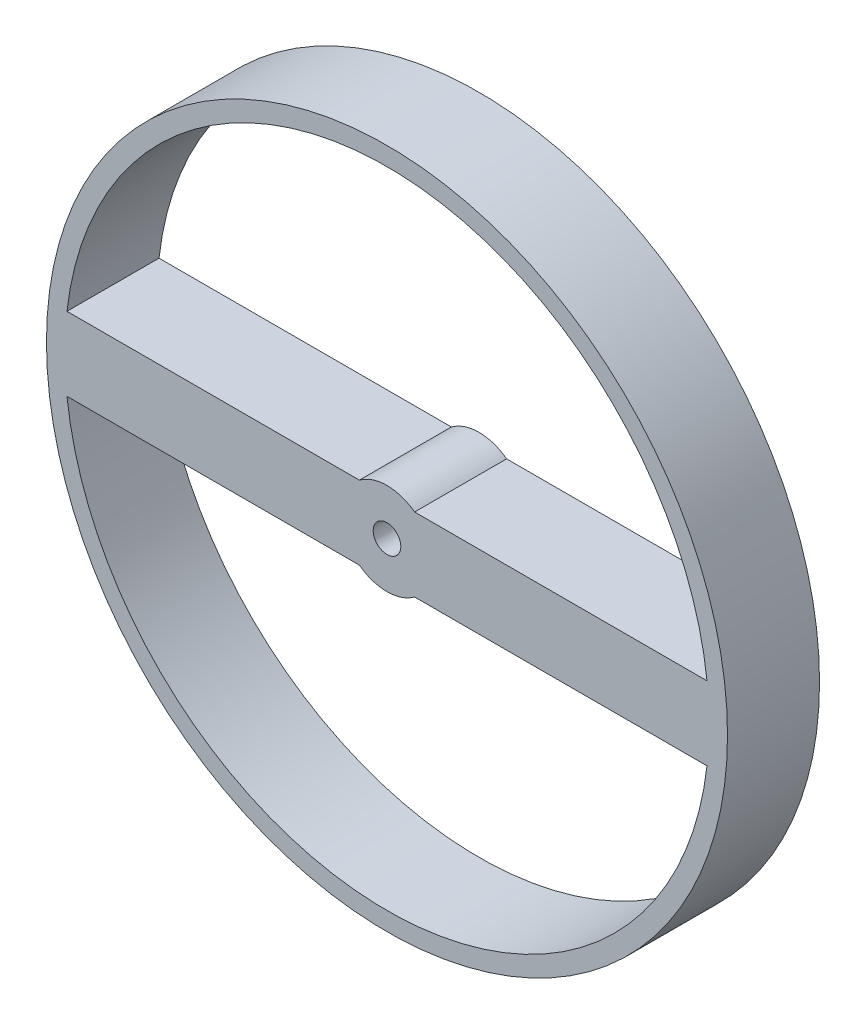
from build123d import *

# Parameters (mm, degrees)
CROQUIS1_R               = 18.5
SALIENTE_EXTRUIR1_DEPTH  = 5
CROQUIS2_R               = 0.75
CORTAR_EXTRUIR1_DEPTH    = 5
CROQUIS3_R               = 17.5
CROQUIS3_R_2             = 2.5
CORTAR_EXTRUIR4_DEPTH    = 5
SALIENTE_EXTRUIR11_START = -5
CROQUIS6_W               = 17.427059278
CROQUIS6_H               = 4
SALIENTE_EXTRUIR11_DEPTH = 5
CROQUIS8_W               = 17.261171747
CROQUIS8_H               = 4
SALIENTE_EXTRUIR12_DEPTH = 5


with BuildPart() as part:
    # Croquis1 → Saliente-Extruir1 (new body)
    with BuildSketch(Plane.XY):
        with Locations((-21.322301086, 7.958835432)):
            Circle(CROQUIS1_R)
    extrude(amount=SALIENTE_EXTRUIR1_DEPTH)

    # Croquis2 → Cortar-Extruir1 (cut)
    with BuildSketch(Plane(origin=(0, 0, 0), x_dir=(-1, 0, 0), z_dir=(0, 0, -1))):
        with Locations((21.322301086, 7.958835432)):
            Circle(CROQUIS2_R)
    extrude(amount=-CORTAR_EXTRUIR1_DEPTH, mode=Mode.SUBTRACT)

    # Croquis3 → Cortar-Extruir4 (cut)
    with BuildSketch(Plane.XY.offset(5)):
        with Locations((-21.322301086, 7.958835432)):
            Circle(CROQUIS3_R)
        with Locations((-21.322301086, 7.958835432)):
            Circle(CROQUIS3_R_2, mode=Mode.SUBTRACT)
    extrude(amount=-CORTAR_EXTRUIR4_DEPTH, mode=Mode.SUBTRACT)


with BuildPart() as cortar_extruir4_piece_1:
    # of the separate pieces the step leaves, piece 1, a body of its own (cortar_extruir4_pieces)
    add(part.part.solids().sort_by_distance((-2.822301086, 7.958835432, 0))[0])



with BuildPart() as cortar_extruir4_piece_2:
    # of the separate pieces the step leaves, piece 2, a body of its own (cortar_extruir4_pieces)
    add(part.part.solids().sort_by_distance((-18.822301086, 7.958835432, 0))[0])


with BuildPart() as cortar_extruir4_piece_1_1:
    add(cortar_extruir4_piece_1.part)

    add(cortar_extruir4_piece_2.part)  # Saliente-Extruir11 merges Cortar-Extruir4 piece 2
    # Croquis6 → Saliente-Extruir11 (add)
    with BuildSketch(Plane.XY.offset(5).offset(SALIENTE_EXTRUIR11_START)):
        with Locations((-31.000345605, 7.958835432)):
            Rectangle(CROQUIS6_W, CROQUIS6_H)
    extrude(amount=SALIENTE_EXTRUIR11_DEPTH)

    # Croquis8 → Saliente-Extruir12 (add)
    with BuildSketch(Plane.XY.offset(5)):
        with Locations((-11.561312802, 7.958835432)):
            Rectangle(CROQUIS8_W, CROQUIS8_H)
    extrude(amount=-SALIENTE_EXTRUIR12_DEPTH)


solid = cortar_extruir4_piece_1_1.part
